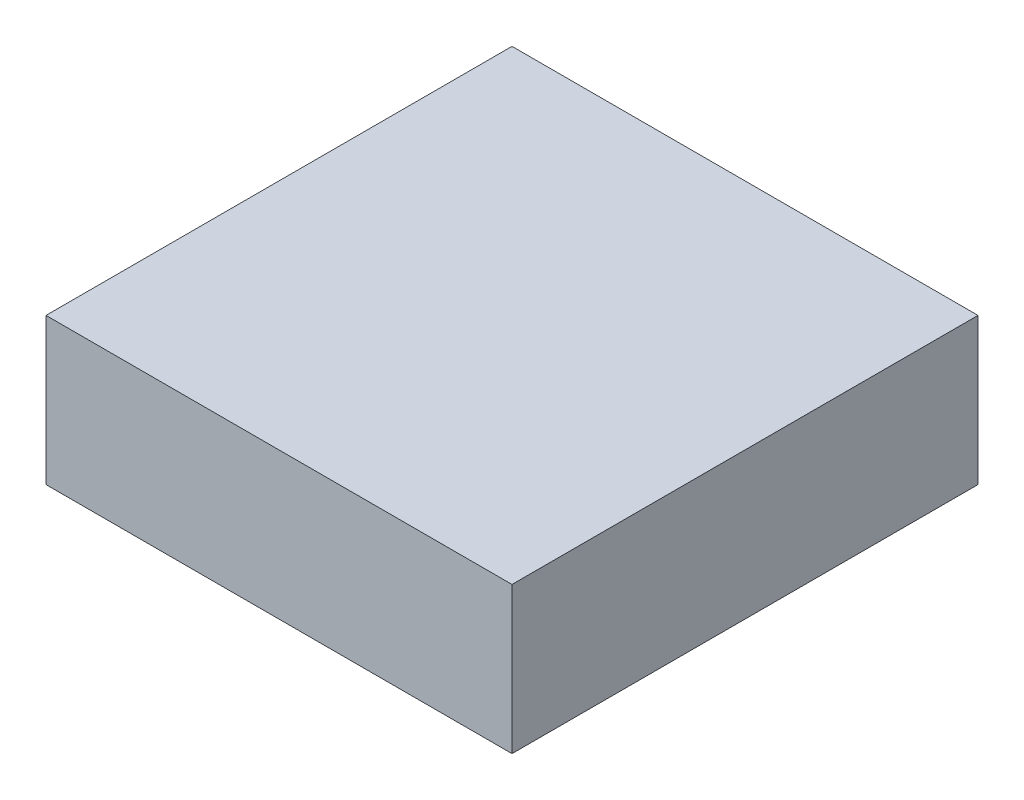
from build123d import *

# Parameters (mm, degrees)
SKETCH1_W           = 31.8
SKETCH1_H           = 31.8
BOSS_EXTRUDE1_DEPTH = 10


with BuildPart() as part:
    # Sketch1 → Boss-Extrude1 (new body)
    with BuildSketch(Plane(origin=(0, 0, 0), x_dir=(1, 0, 0), z_dir=(0, 1, 0))):
        Rectangle(SKETCH1_W, SKETCH1_H)
    extrude(amount=BOSS_EXTRUDE1_DEPTH)


solid = part.part
